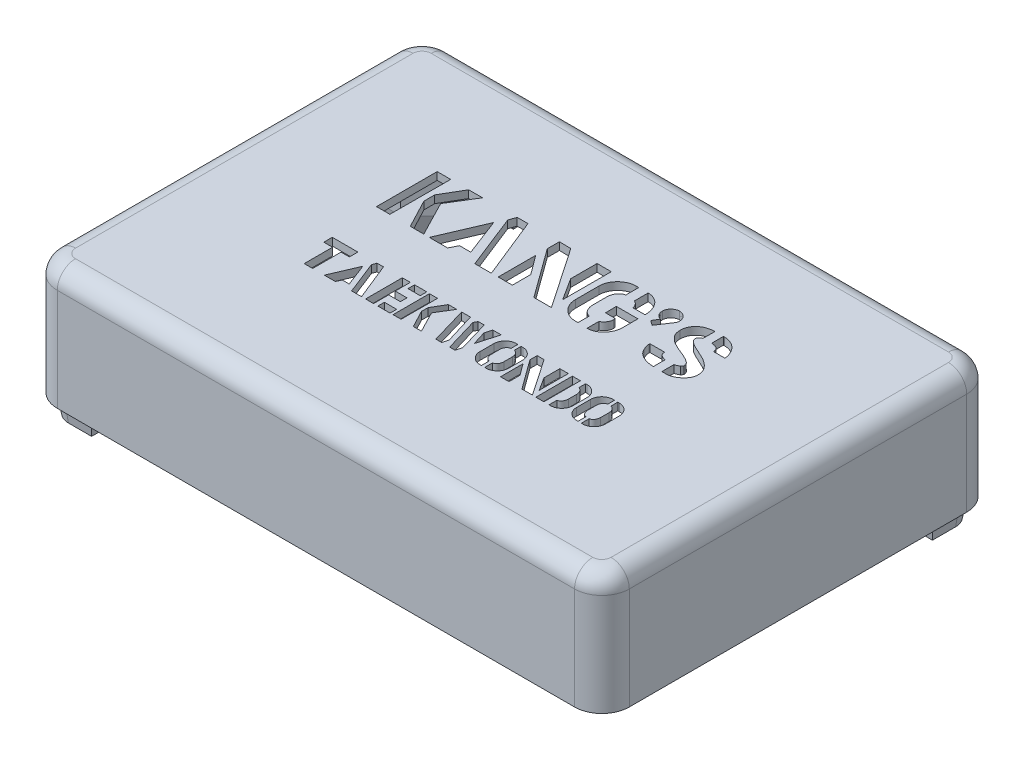
from build123d import *

# Parameters (mm, degrees)
BOSS_EXTRUDE1_DEPTH           = 1.25
BOSS_EXTRUDE2_START           = -18.551161966
BOSS_EXTRUDE2_DEPTH           = 18.551161966
CUT_EXTRUDE1_REACH            = 87.168
SKETCH2_W                     = 44.73
SKETCH2_H                     = 13.53
SKETCH2_W_2                   = 14.25
BOSS_EXTRUDE3_DEPTH           = 18.551161966
BOSS_EXTRUDE4_START           = 18.551162
BOSS_EXTRUDE4_DEPTH           = 3
BOSS_EXTRUDE4_DRAFT           = 10
BOSS_EXTRUDE4_PROFILE_2_DEPTH = 3
BOSS_EXTRUDE4_PROFILE_2_DRAFT = 10
BOSS_EXTRUDE4_PROFILE_3_DEPTH = 3
BOSS_EXTRUDE4_PROFILE_3_DRAFT = 10
FILLET1_R                     = 3
SKETCH4_W                     = 8.836090639
SKETCH4_H                     = 8.085533906
CUT_EXTRUDE2_DEPTH            = 67.181962882
SKETCH5_W                     = 2.014527845
SKETCH5_H                     = 1.084745763
SKETCH5_W_2                   = 1.317191283
SKETCH5_H_2                   = 6
CUT_EXTRUDE3_DEPTH            = 68.140592671


with BuildPart() as part:
    # Sketch1 → Boss-Extrude1 (new body)
    # profile 1 of 2: a face of its own
    with BuildSketch(Plane(origin=(0, 0, 0), x_dir=(1, 0, 0), z_dir=(0, 1, 0))):
        with BuildLine():
            ThreePointArc((-37, -35.095814403), (-40.181980515, -33.777794919), (-41.5, -30.595814403))
            Line((-41.5, -30.595814403), (-41.5, 24.85))
            ThreePointArc((-41.5, 24.85), (-40.181980515, 28.031980515), (-37, 29.35))
            Line((-37, 29.35), (48, 29.35))
            ThreePointArc((48, 29.35), (51.181980515, 28.031980515), (52.5, 24.85))
            Line((52.5, 24.85), (52.5, -30.595814403))
            ThreePointArc((52.5, -30.595814403), (51.181980515, -33.777794919), (48, -35.095814403))
            Line((48, -35.095814403), (-37, -35.095814403))
        make_face()
        with BuildLine():
            Line((-37, 27.85), (48, 27.85))
            ThreePointArc((48, 27.85), (50.121320344, 26.971320344), (51, 24.85))
            Line((51, 24.85), (51, -30.595814403))
            ThreePointArc((51, -30.595814403), (50.121320344, -32.717134747), (48, -33.595814403))
            Line((48, -33.595814403), (-37, -33.595814403))
            ThreePointArc((-37, -33.595814403), (-39.121320344, -32.717134747), (-40, -30.595814403))
            Line((-40, -30.595814403), (-40, 24.85))
            ThreePointArc((-40, 24.85), (-39.121320344, 26.971320344), (-37, 27.85))
        make_face(mode=Mode.SUBTRACT)
    # profile 2 of 2: a face of its own
    with BuildSketch(Plane(origin=(0, 0, 0), x_dir=(1, 0, 0), z_dir=(0, 1, 0))):
        with BuildLine():
            ThreePointArc((48, 27.85), (50.121320344, 26.971320344), (51, 24.85))
            Line((51, 24.85), (51, -30.595814403))
            ThreePointArc((51, -30.595814403), (50.121320344, -32.717134747), (48, -33.595814403))
            Line((48, -33.595814403), (-37, -33.595814403))
            ThreePointArc((-37, -33.595814403), (-39.121320344, -32.717134747), (-40, -30.595814403))
            Line((-40, -30.595814403), (-40, 24.85))
            ThreePointArc((-40, 24.85), (-39.121320344, 26.971320344), (-37, 27.85))
            Line((-37, 27.85), (48, 27.85))
        make_face()
    extrude(amount=BOSS_EXTRUDE1_DEPTH)

    # Sketch1<3> → Boss-Extrude2 (add)
    with BuildSketch(Plane(origin=(0, 0, 0), x_dir=(1, 0, 0), z_dir=(0, 1, 0)).offset(BOSS_EXTRUDE2_START)):
        with BuildLine():
            Line((-41.5, -30.595814403), (-41.5, 24.85))
            ThreePointArc((-41.5, 24.85), (-40.181980515, 28.031980515), (-37, 29.35))
            Line((-37, 29.35), (48, 29.35))
            ThreePointArc((48, 29.35), (51.181980515, 28.031980515), (52.5, 24.85))
            Line((52.5, 24.85), (52.5, -30.595814403))
            ThreePointArc((52.5, -30.595814403), (51.181980515, -33.777794919), (48, -35.095814403))
            Line((48, -35.095814403), (-37, -35.095814403))
            ThreePointArc((-37, -35.095814403), (-40.181980515, -33.777794919), (-41.5, -30.595814403))
        make_face()
        with BuildLine():
            Line((-37, -33.595814403), (48, -33.595814403))
            ThreePointArc((48, -33.595814403), (50.121320344, -32.717134747), (51, -30.595814403))
            Line((51, -30.595814403), (51, 24.85))
            ThreePointArc((51, 24.85), (50.121320344, 26.971320344), (48, 27.85))
            Line((48, 27.85), (-37, 27.85))
            ThreePointArc((-37, 27.85), (-39.121320344, 26.971320344), (-40, 24.85))
            Line((-40, 24.85), (-40, -30.595814403))
            ThreePointArc((-40, -30.595814403), (-39.121320344, -32.717134747), (-37, -33.595814403))
        make_face(mode=Mode.SUBTRACT)
    extrude(amount=BOSS_EXTRUDE2_DEPTH)

    # Sketch2 → Cut-Extrude1 (cut, up to next)
    with BuildSketch(Plane(origin=(0, 0, -29.35), x_dir=(-1, 0, 0), z_dir=(0, 0, -1)), mode=Mode.PRIVATE) as cut_extrude1_sk1:
        with Locations((2.66, -11.786161966)):
            Rectangle(SKETCH2_W, SKETCH2_H)
    cut_extrude1_tool1 = extrude(cut_extrude1_sk1.sketch, amount=-CUT_EXTRUDE1_REACH, mode=Mode.PRIVATE) & part.part
    # Sketch2 → Cut-Extrude1 (cut, up to next)
    with BuildSketch(Plane(origin=(0, 0, -29.35), x_dir=(-1, 0, 0), z_dir=(0, 0, -1)), mode=Mode.PRIVATE) as cut_extrude1_sk2:
        with Locations((-32.9, -11.786161966)):
            Rectangle(SKETCH2_W_2, SKETCH2_H)
    cut_extrude1_tool2 = extrude(cut_extrude1_sk2.sketch, amount=-CUT_EXTRUDE1_REACH, mode=Mode.PRIVATE) & part.part
    add(cut_extrude1_tool1.solids().sort_by_distance((-2.66, -11.786162, -29.35))[0], mode=Mode.SUBTRACT)
    add(cut_extrude1_tool2.solids().sort_by_distance((32.9, -11.786162, -29.35))[0], mode=Mode.SUBTRACT)

    # Sketch3 → Boss-Extrude3 (add)
    with BuildSketch(Plane.XZ):
        with BuildLine():
            Line((-32.664466094, -28.05), (-32.664466094, -24.05))
            Line((-32.664466094, -24.05), (-36.2, -20.514466094))
            Line((-36.2, -20.514466094), (-40.2, -20.514466094))
            Line((-40.2, -20.514466094), (-40.2, -24.85))
            ThreePointArc((-40.2, -24.85), (-39.2627417, -27.1127417), (-37, -28.05))
            Line((-37, -28.05), (-32.664466094, -28.05))
        make_face()
        with BuildLine():
            Line((-40.2, 26.260280497), (-36.2, 26.260280497))
            Line((-36.2, 26.260280497), (-32.664466094, 29.795814403))
            Line((-32.664466094, 29.795814403), (-32.664466094, 33.795814403))
            Line((-32.664466094, 33.795814403), (-37, 33.795814403))
            ThreePointArc((-37, 33.795814403), (-39.2627417, 32.858556103), (-40.2, 30.595814403))
            Line((-40.2, 30.595814403), (-40.2, 26.260280497))
        make_face()
        with BuildLine():
            Line((47.2, -20.514466094), (43.664466094, -24.05))
            Line((43.664466094, -24.05), (43.664466094, -28.05))
            Line((43.664466094, -28.05), (48, -28.05))
            ThreePointArc((48, -28.05), (50.2627417, -27.1127417), (51.2, -24.85))
            Line((51.2, -24.85), (51.2, -20.514466094))
            Line((51.2, -20.514466094), (47.2, -20.514466094))
        make_face()
    extrude(amount=BOSS_EXTRUDE3_DEPTH)


with BuildPart() as boss_extrude4_tool:
    # Sketch3<3> → Boss-Extrude4 (with draft: the straight prism first)
    with BuildSketch(Plane.XZ.offset(BOSS_EXTRUDE4_START)):
        with BuildLine():
            Line((-32.664466094, -24.05), (-36.2, -20.514466094))
            Line((-36.2, -20.514466094), (-40.2, -20.514466094))
            Line((-40.2, -20.514466094), (-40.2, -24.85))
            ThreePointArc((-40.2, -24.85), (-39.2627417, -27.1127417), (-37, -28.05))
            Line((-37, -28.05), (-32.664466094, -28.05))
            Line((-32.664466094, -28.05), (-32.664466094, -24.05))
        make_face()
    extrude(amount=BOSS_EXTRUDE4_DEPTH)
    # Boss-Extrude4: the draft: its side faces are tilted about the plane it starts from
    boss_extrude4_sides = [boss_extrude4_tool.faces().sort_by_distance(p)[0] for p in [
        (-34.832233047, -20.051162, -28.05),
        (-32.664466094, -20.051162, -26.05),
        (-34.432233047, -20.051162, -22.282233047),
        (-38.2, -20.051162, -20.514466094),
        (-40.2, -20.051162, -22.682233047),
        (-39.2627417, -20.051162, -27.1127417),
    ]]
    draft(boss_extrude4_sides, Plane.XZ.offset(BOSS_EXTRUDE4_START), BOSS_EXTRUDE4_DRAFT)


with BuildPart() as part_1:
    add(part.part)

    # Boss-Extrude4: add boss_extrude4_tool
    add(boss_extrude4_tool.part)


with BuildPart() as boss_extrude4_profile_2_tool:
    # Sketch3<3> → Boss-Extrude4 profile 2 (with draft: the straight prism first)
    with BuildSketch(Plane.XZ.offset(BOSS_EXTRUDE4_START)):
        with BuildLine():
            Line((-36.2, 26.260280497), (-32.664466094, 29.795814403))
            Line((-32.664466094, 29.795814403), (-32.664466094, 33.795814403))
            Line((-32.664466094, 33.795814403), (-37, 33.795814403))
            ThreePointArc((-37, 33.795814403), (-39.2627417, 32.858556103), (-40.2, 30.595814403))
            Line((-40.2, 30.595814403), (-40.2, 26.260280497))
            Line((-40.2, 26.260280497), (-36.2, 26.260280497))
        make_face()
    extrude(amount=BOSS_EXTRUDE4_PROFILE_2_DEPTH)
    # Boss-Extrude4 profile 2: the draft: its side faces are tilted about the plane it starts from
    boss_extrude4_profile_2_sides = [boss_extrude4_profile_2_tool.faces().sort_by_distance(p)[0] for p in [
        (-34.432233047, -20.051162, 28.02804745),
        (-32.664466094, -20.051162, 31.795814403),
        (-34.832233047, -20.051162, 33.795814403),
        (-39.2627417, -20.051162, 32.858556103),
        (-40.2, -20.051162, 28.42804745),
        (-38.2, -20.051162, 26.260280497),
    ]]
    draft(boss_extrude4_profile_2_sides, Plane.XZ.offset(BOSS_EXTRUDE4_START), BOSS_EXTRUDE4_PROFILE_2_DRAFT)


with BuildPart() as part_2:
    add(part_1.part)

    # Boss-Extrude4 profile 2: add boss_extrude4_profile_2_tool
    add(boss_extrude4_profile_2_tool.part)


with BuildPart() as boss_extrude4_profile_3_tool:
    # Sketch3<3> → Boss-Extrude4 profile 3 (with draft: the straight prism first)
    with BuildSketch(Plane.XZ.offset(BOSS_EXTRUDE4_START)):
        with BuildLine():
            Line((43.664466094, -24.05), (43.664466094, -28.05))
            Line((43.664466094, -28.05), (48, -28.05))
            ThreePointArc((48, -28.05), (50.2627417, -27.1127417), (51.2, -24.85))
            Line((51.2, -24.85), (51.2, -20.514466094))
            Line((51.2, -20.514466094), (47.2, -20.514466094))
            Line((47.2, -20.514466094), (43.664466094, -24.05))
        make_face()
    extrude(amount=BOSS_EXTRUDE4_PROFILE_3_DEPTH)
    # Boss-Extrude4 profile 3: the draft: its side faces are tilted about the plane it starts from
    boss_extrude4_profile_3_sides = [boss_extrude4_profile_3_tool.faces().sort_by_distance(p)[0] for p in [
        (43.664466094, -20.051162, -26.05),
        (45.832233047, -20.051162, -28.05),
        (50.2627417, -20.051162, -27.1127417),
        (51.2, -20.051162, -22.682233047),
        (49.2, -20.051162, -20.514466094),
        (45.432233047, -20.051162, -22.282233047),
    ]]
    draft(boss_extrude4_profile_3_sides, Plane.XZ.offset(BOSS_EXTRUDE4_START), BOSS_EXTRUDE4_PROFILE_3_DRAFT)


with BuildPart() as part_3:
    add(part_2.part)

    # Boss-Extrude4 profile 3: add boss_extrude4_profile_3_tool
    add(boss_extrude4_profile_3_tool.part)

    # Fillet1
    fillet1_edges = [part_3.edges().sort_by_distance(p)[0] for p in [
        (-34.432233047, 0, -22.282233047),
        (51.181980515, 1.25, 33.777794919),
        (7.667766953, 0, 33.595814403),
        (-38.1, 0, 26.260280497),
        (-32.664466094, 0, 31.695814403),
        (-34.432233047, 0, 28.02804745),
        (5.5, 0, -27.85),
        (43.664466094, 0, -25.95),
        (49.1, 0, -20.514466094),
        (45.432233047, 0, -22.282233047),
        (52.5, 1.25, 2.872907202),
        (51.181980515, 1.25, -28.031980515),
        (5.5, 1.25, -29.35),
        (-40.181980515, 1.25, -28.031980515),
        (50.121320344, 0, 32.717134747),
        (-41.5, 1.25, 2.872907202),
        (51, 0, 5.040674155),
        (-40.181980515, 1.25, 33.777794919),
        (5.5, 1.25, 35.095814403),
        (-40, 0, 2.872907202),
        (-32.664466094, 0, -25.95),
        (-38.1, 0, -20.514466094),
    ]]
    fillet(fillet1_edges, radius=FILLET1_R)

    # Sketch4 → Cut-Extrude2 (cut, through all)
    with BuildSketch(Plane.XZ.offset(18.551161966)):
        with Locations((42.031954681, -25.307233047)):
            Rectangle(SKETCH4_W, SKETCH4_H)
    extrude(amount=CUT_EXTRUDE2_DEPTH, mode=Mode.SUBTRACT)

    # Sketch5 → Cut-Extrude3 (cut, through all)
    with BuildSketch(Plane(origin=(0, 1.25, 0), x_dir=(1, 0, 0), z_dir=(0, 1, 0))):
        Polygon((-12.217917676, 10.014124294), (-14.838983051, 5.746569814), (-11.882970137, 0.014124294), (-14.100484262, 0.014124294), (-16.568200161, 4.713478612), (-16.568200161, 6.499192897), (-14.504035513, 10.014124294), align=None)
        Polygon((-17.486279257, 0.042372881), (-19.681598063, 0.042372881), (-19.681598063, 10.014124294), (-17.45803067, 10.014124294), align=None)
        Polygon((-4.820823245, 10.072639225), (-0.761097659, 0), (-3.481033091, 0), (-6.995964487, 8.92251816), (-6.59039548, 10.072639225), align=None)
        Polygon((-10.97094431, 0), (-7.790960452, 7.407183212), (-5.44834544, 1.305488297), (-7.302663438, 1.305488297), (-7.958434221, 0), align=None)
        Polygon((2.245359161, 10.044390638), (9.065375303, 0.044390638), (6.177966102, 0.044390638), (0.334543987, 8.091202583), (0.348668281, 10.072639225), align=None)
        Polygon((6.533091203, 5.734463277), (6.533091203, 10.072639225), (8.871670702, 10.072639225), (8.857546408, 2.094430993), align=None)
        Polygon((2.658999193, 0.028248588), (0.334543987, 0.028248588), (0.334543987, 6.192493947), (2.658999193, 3.05488297), align=None)
        with BuildLine():
            Line((13.383373688, 0.086763519), (12.95157385, 0.086763519))
            add(Edge.make_bspline(
                [(12.95157385, 0.086763519), (12.848511171, 0.090046505), (12.643365201, 0.096581279), (12.339999042, 0.143543833), (12.044994232, 0.223721271), (11.759336815, 0.331711932), (11.488708969, 0.46903058), (11.234686297, 0.627785702), (10.997967353, 0.804784151), (10.781065452, 1.003534163), (10.585555193, 1.221496062), (10.410885433, 1.45742119), (10.256842547, 1.710332663), (10.126435505, 1.979853331), (10.020536893, 2.261839894), (9.947201843, 2.553653952), (9.897527741, 2.851411079), (9.892941351, 3.052663874), (9.890637611, 3.153753027)],
                knots=[0, 0, 0, 0, 1.030497233, 2.05120183, 3.061145804, 4.082980002, 5.099687741, 6.090707789, 7.075407959, 8.051339886, 9.027735263, 9.998997243, 10.982962048, 11.98469761, 12.989206787, 13.989224726, 14.989988836, 16, 16, 16, 16], degree=3))
            Line((9.890637611, 3.153753027), (9.890637611, 7.003631961))
            add(Edge.make_bspline(
                [(9.890637611, 7.003631961), (9.892958487, 7.104716525), (9.897578991, 7.305960183), (9.946892184, 7.603141069), (10.020949214, 7.894083658), (10.126300824, 8.175579292), (10.257445622, 8.445348196), (10.410260404, 8.699656309), (10.585536158, 8.935951531), (10.781731285, 9.153780969), (10.997221774, 9.354786207), (11.234876178, 9.531314267), (11.488070847, 9.690992483), (11.760384667, 9.824644934), (12.044439876, 9.936404647), (12.340085237, 10.015648014), (12.643343315, 10.062875015), (12.848503853, 10.069374146), (12.95157385, 10.072639225)],
                knots=[0, 0, 0, 0, 1.009809341, 2.010373476, 3.00367982, 4.007988273, 5.009523666, 5.99904406, 6.970111961, 7.946312232, 8.926603665, 9.911107069, 10.901929089, 11.915426284, 12.939465882, 13.949208046, 14.969708683, 16, 16, 16, 16], degree=3))
            Line((12.95157385, 10.072639225), (13.383373688, 10.072639225))
            Line((13.383373688, 10.072639225), (13.383373688, 7.937853107))
            add(Edge.make_bspline(
                [(13.383373688, 7.937853107), (13.33129642, 7.929026033), (13.229042513, 7.91169404), (13.081857766, 7.864192696), (12.943617758, 7.799937245), (12.77569429, 7.688364067), (12.587265134, 7.520998207), (12.404519945, 7.278959989), (12.263733351, 7.006353522), (12.163120275, 6.71377729), (12.097846959, 6.413247789), (12.089868334, 6.210963575), (12.085956416, 6.111783697)],
                knots=[0, 0, 0, 0, 0.649488645, 1.275273328, 1.897487876, 2.51981258, 3.7512292, 4.979915218, 6.231594117, 7.5119956, 8.780132316, 10, 10, 10, 10], degree=3))
            Line((12.085956416, 6.111783697), (12.085956416, 3.795399516))
            add(Edge.make_bspline(
                [(12.085956416, 3.795399516), (12.089849874, 3.696892666), (12.097766348, 3.496601034), (12.16291171, 3.199286505), (12.265445898, 2.908948641), (12.4048923, 2.63412823), (12.586155528, 2.387085797), (12.774265089, 2.216075812), (12.944258669, 2.107574115), (13.081774425, 2.042860946), (13.229064323, 1.99552308), (13.33130378, 1.978168621), (13.383373688, 1.969330105)],
                knots=[0, 0, 0, 0, 1.212153435, 2.464642723, 3.729993484, 4.996942749, 6.246031211, 7.483531307, 8.101657328, 8.724152176, 9.350218768, 10, 10, 10, 10], degree=3))
            Line((13.383373688, 1.969330105), (13.383373688, 0.086763519))
        make_face()
        with BuildLine():
            Line((14.244955609, 3.744955609), (14.216707022, 5.552865214))
            Line((14.216707022, 5.552865214), (17.767958031, 5.552865214))
            Line((17.767958031, 5.552865214), (17.767958031, 3.089184826))
            add(Edge.make_bspline(
                [(17.767958031, 3.089184826), (17.76488189, 2.988202025), (17.758789676, 2.788208245), (17.720992417, 2.491038189), (17.650920137, 2.203302706), (17.558963429, 1.92396396), (17.440695002, 1.658249958), (17.305215394, 1.404189997), (17.141612691, 1.170114897), (16.960861938, 0.951905271), (16.760073974, 0.753275428), (16.541110659, 0.574963881), (16.304726836, 0.417342419), (16.052077076, 0.282149235), (15.787101141, 0.170745444), (15.509743183, 0.089326617), (15.222001172, 0.038196816), (15.02602815, 0.02756836), (14.926957224, 0.022195319)],
                knots=[0, 0, 0, 0, 1.046784458, 2.073129081, 3.097767789, 4.111799308, 5.116877793, 6.108840655, 7.091130162, 8.071141376, 9.042211172, 10.013356029, 10.993590353, 11.982240979, 12.979090627, 13.967298783, 14.972401443, 16, 16, 16, 16], degree=3))
            Line((14.926957224, 0.022195319), (14.926957224, 1.987489911))
            add(Edge.make_bspline(
                [(14.926957224, 1.987489911), (14.991912137, 2.018568616), (15.122632679, 2.081113924), (15.301693108, 2.210814407), (15.464315503, 2.370766688), (15.609144217, 2.556108769), (15.730940101, 2.758324228), (15.821890026, 2.970320805), (15.876306043, 3.188700808), (15.883716506, 3.336405575), (15.887409201, 3.410008071)],
                knots=[0, 0, 0, 0, 0.954037792, 1.919983107, 2.917213139, 3.972428214, 5.033177375, 6.041054575, 7.023841438, 8, 8, 8, 8], degree=3))
            add(Edge.make_bspline(
                [(15.887409201, 3.410008071), (15.886414413, 3.435595214), (15.884235975, 3.491627249), (15.873083781, 3.57754354), (15.862971044, 3.663961655), (15.852067417, 3.719445077), (15.847054076, 3.744955609)],
                knots=[0, 0, 0, 0, 0.909440179, 1.991538659, 3.076536445, 4, 4, 4, 4], degree=3))
            Line((15.847054076, 3.744955609), (14.244955609, 3.744955609))
        make_face()
        with BuildLine():
            add(Edge.make_bspline(
                [(15.804681195, 6.715092817), (15.785500983, 6.775312296), (15.747657417, 6.894128498), (15.674270636, 7.064087727), (15.589306954, 7.224045318), (15.492740436, 7.374781946), (15.379815352, 7.513156482), (15.247658057, 7.634974393), (15.096252447, 7.739935323), (14.984299266, 7.793425669), (14.926957224, 7.820823245)],
                knots=[0, 0, 0, 0, 1.038117861, 2.048261179, 3.037197711, 4.012136952, 4.985822251, 5.963576981, 6.956950992, 8, 8, 8, 8], degree=3))
            Line((14.926957224, 7.820823245), (14.926957224, 10.072639225))
            add(Edge.make_bspline(
                [(14.926957224, 10.072639225), (15.038148399, 10.066899214), (15.25586436, 10.055660083), (15.572195859, 9.999741696), (15.867831549, 9.905510218), (16.142372203, 9.779511749), (16.397697939, 9.628288656), (16.62993474, 9.451590766), (16.842500733, 9.254385419), (17.031477157, 9.034247449), (17.199001939, 8.793865114), (17.349596649, 8.538710215), (17.473410065, 8.263487904), (17.581025451, 7.975490417), (17.66599749, 7.67399004), (17.722958816, 7.361761273), (17.761431374, 7.041581184), (17.765764148, 6.824839208), (17.767958031, 6.715092817)],
                knots=[0, 0, 0, 0, 1.089548312, 2.13337127, 3.135233695, 4.119604243, 5.085313417, 6.035012562, 6.971627958, 7.919567108, 8.869700036, 9.837741952, 10.816123728, 11.820515648, 12.846399576, 13.878458949, 14.925766581, 16, 16, 16, 16], degree=3))
            Line((17.767958031, 6.715092817), (15.804681195, 6.715092817))
        make_face()
        with BuildLine():
            Line((19.059322034, 6.361985472), (19.646489104, 7.352703793))
            add(Edge.make_bspline(
                [(19.646489104, 7.352703793), (19.575530791, 7.37582894), (19.43597432, 7.421310063), (19.245593422, 7.531085277), (19.078407529, 7.670753145), (18.933271926, 7.835622126), (18.816412071, 8.022383475), (18.733332786, 8.22514302), (18.680185326, 8.439574026), (18.674698303, 8.587256868), (18.671912833, 8.662227603)],
                knots=[0, 0, 0, 0, 1.018864026, 2.003839468, 2.984075487, 3.98820656, 4.99675493, 5.9827614, 6.9759551, 8, 8, 8, 8], degree=3))
            add(Edge.make_bspline(
                [(18.671912833, 8.662227603), (18.673544272, 8.710743916), (18.67675648, 8.806269662), (18.69987097, 8.946910463), (18.736144971, 9.082875915), (18.803104456, 9.25602934), (18.915930552, 9.456347641), (19.091510478, 9.664724476), (19.301856614, 9.836218491), (19.501603026, 9.944605731), (19.671350984, 10.01315226), (19.806691847, 10.046131155), (19.944923605, 10.07025761), (20.039171197, 10.071844624), (20.086359968, 10.072639225)],
                knots=[0, 0, 0, 0, 0.78996274, 1.55538982, 2.31538855, 3.078302937, 4.574346892, 6.035901131, 7.49190241, 8.967715255, 9.72041529, 10.467032153, 11.232459233, 12, 12, 12, 12], degree=3))
            add(Edge.make_bspline(
                [(20.086359968, 10.072639225), (20.180561667, 10.067428905), (20.368167708, 10.057052366), (20.635731044, 9.966803121), (20.879926063, 9.837202304), (21.09323168, 9.66533986), (21.268676296, 9.456250607), (21.382216166, 9.256158148), (21.447883943, 9.082492337), (21.48829792, 8.947479602), (21.507206532, 8.806014519), (21.510990018, 8.710692034), (21.51291364, 8.662227603)],
                knots=[0, 0, 0, 0, 1.269612719, 2.528478964, 3.776737799, 4.991667953, 6.204148375, 7.445240876, 8.078141615, 8.711042355, 9.34466041, 10, 10, 10, 10], degree=3))
            add(Edge.make_bspline(
                [(21.51291364, 8.662227603), (21.51189001, 8.606930897), (21.509978663, 8.50367957), (21.482812393, 8.360804563), (21.442929562, 8.236584875), (21.392035308, 8.125304076), (21.330705885, 8.020785381), (21.256627402, 7.921061016), (21.176305655, 7.812303055), (21.127482614, 7.731173498), (21.101291364, 7.687651332)],
                knots=[0, 0, 0, 0, 1.225871234, 2.288975967, 3.214512543, 4.116626368, 5.000135334, 5.899278413, 6.87306233, 8, 8, 8, 8], degree=3))
            Line((21.101291364, 7.687651332), (19.852300242, 5.790960452))
            Line((19.852300242, 5.790960452), (19.059322034, 6.361985472))
        make_face()
        with BuildLine():
            add(Edge.make_bspline(
                [(25.82889427, 0.014124294), (25.67730622, 0.022946992), (25.36645531, 0.041039076), (24.89871411, 0.11863732), (24.43237985, 0.239384478), (24.055935214, 0.380400028), (23.769438133, 0.51927915), (23.566287673, 0.641381194), (23.370696931, 0.775083402), (23.185596198, 0.923037832), (23.015135836, 1.087507813), (22.867079524, 1.272067766), (22.73657888, 1.470639688), (22.668776893, 1.614648919), (22.634786118, 1.686844229)],
                knots=[0, 0, 0, 0, 1.439726894, 2.952346293, 4.489130685, 6.003632958, 6.756976197, 7.506554119, 8.249887153, 9.003230392, 9.752237807, 10.491644445, 11.243824887, 12, 12, 12, 12], degree=3))
            add(Edge.make_bspline(
                [(22.634786118, 1.686844229), (22.59453223, 1.779705988), (22.515078191, 1.962998636), (22.414607382, 2.190718989), (22.347068868, 2.376633409), (22.314226535, 2.5230874), (22.289909338, 2.67473626), (22.288464865, 2.778347191), (22.287732042, 2.830912026)],
                knots=[0, 0, 0, 0, 1.510042566, 2.980556321, 3.713652942, 4.456031365, 5.216699857, 6, 6, 6, 6], degree=3))
            add(Edge.make_bspline(
                [(22.287732042, 2.830912026), (22.287732042, 2.859160613), (22.287732042, 2.914985203), (22.287732042, 2.970809793), (22.287732042, 2.998385795)],
                knots=[0, 0, 0, 0, 1.012048193, 2, 2, 2, 2], degree=3))
            Line((22.287732042, 2.998385795), (24.741323648, 2.998385795))
            Line((24.741323648, 2.998385795), (24.741323648, 2.802663438))
            add(Edge.make_bspline(
                [(24.741323648, 2.802663438), (24.739883167, 2.772948788), (24.737036468, 2.714226249), (24.757809085, 2.629381857), (24.787584139, 2.547039095), (24.854274751, 2.445991471), (24.963623749, 2.333520694), (25.117267577, 2.218112692), (25.292418193, 2.127054912), (25.475761224, 2.053469428), (25.656840801, 2.003950329), (25.774311932, 1.978935402), (25.82889427, 1.967312349)],
                knots=[0, 0, 0, 0, 0.597137178, 1.180071491, 1.747150478, 2.357104528, 3.605221461, 4.894494913, 6.218096733, 7.57644755, 8.873909208, 10, 10, 10, 10], degree=3))
            Line((25.82889427, 1.967312349), (25.82889427, 0.014124294))
        make_face()
        with BuildLine():
            add(Edge.make_bspline(
                [(22.856739306, 7.395076675), (22.859915955, 7.498817924), (22.866137267, 7.701990119), (22.912514814, 7.997586346), (22.991793505, 8.274491008), (23.101091481, 8.532691411), (23.240010081, 8.770138886), (23.397012906, 8.991306583), (23.575642435, 9.192228844), (23.775046519, 9.372817237), (23.993101058, 9.53357988), (24.22797621, 9.676649184), (24.481671392, 9.793735016), (24.747333205, 9.896022626), (25.025523856, 9.972544528), (25.310113403, 10.033345488), (25.602212207, 10.064495988), (25.798568152, 10.06991099), (25.897497982, 10.072639225)],
                knots=[0, 0, 0, 0, 1.098939009, 2.152218648, 3.160466161, 4.143929449, 5.114475637, 6.069646961, 7.013586876, 7.956988626, 8.914788172, 9.880297979, 10.865334996, 11.871237597, 12.893193182, 13.919042323, 14.951553052, 16, 16, 16, 16], degree=3))
            Line((25.897497982, 10.072639225), (25.897497982, 8.13559322))
            add(Edge.make_bspline(
                [(25.897497982, 8.13559322), (25.868595197, 8.115390243), (25.808034836, 8.073058697), (25.714024738, 8.00812516), (25.616931403, 7.934977448), (25.519965377, 7.857267039), (25.430142506, 7.772059502), (25.359270721, 7.677661222), (25.30790864, 7.575282783), (25.301423891, 7.501903042), (25.298224374, 7.465698144)],
                knots=[0, 0, 0, 0, 0.908146097, 1.902849668, 2.942098635, 4.037700156, 5.103317531, 6.118323267, 7.071597793, 8, 8, 8, 8], degree=3))
            add(Edge.make_bspline(
                [(25.298224374, 7.465698144), (25.302576805, 7.397689312), (25.31125455, 7.262095342), (25.392486823, 7.068071574), (25.520937108, 6.889940609), (25.698798897, 6.73029363), (25.911673651, 6.582244458), (26.150361847, 6.435579818), (26.413325264, 6.288843089), (26.808935311, 6.10066802), (27.342014325, 5.863791833), (27.891153467, 5.618011716), (28.343503915, 5.414671951), (28.671886742, 5.235953765), (28.99200159, 5.050591567), (29.295533361, 4.845720104), (29.585121547, 4.631565858), (29.847190619, 4.392942401), (30.082738223, 4.136999718), (30.294645688, 3.863853371), (30.469418151, 3.564119373), (30.592785073, 3.231337938), (30.6694332, 2.868703402), (30.677460606, 2.616081306), (30.681598063, 2.485875706)],
                knots=[0, 0, 0, 0, 0.573914816, 1.144254158, 1.753009416, 2.422307235, 3.157582464, 3.948246568, 4.795048198, 5.707411794, 7.658392333, 9.737205835, 10.805399197, 11.858237929, 12.902949619, 13.938122644, 14.959257865, 15.951640193, 16.935610678, 17.90320935, 18.875745166, 19.862138112, 20.898110686, 22, 22, 22, 22], degree=3))
            add(Edge.make_bspline(
                [(30.681598063, 2.485875706), (30.679219326, 2.407603623), (30.674440024, 2.250341176), (30.624786085, 2.018229817), (30.5509775, 1.788936348), (30.441749872, 1.569171456), (30.313973584, 1.356225953), (30.164925637, 1.154539004), (29.997222788, 0.965852723), (29.814644461, 0.787966607), (29.615725079, 0.627853306), (29.408622908, 0.478579689), (29.187738673, 0.351094615), (28.961735544, 0.237068268), (28.730230936, 0.147511612), (28.500733339, 0.077358444), (28.272534346, 0.034161454), (28.121223806, 0.023454068), (28.046408394, 0.018159806)],
                knots=[0, 0, 0, 0, 0.955740518, 1.920251582, 2.890321632, 3.894514103, 4.912852476, 5.924460272, 6.955767427, 7.996865693, 9.037281579, 10.075549928, 11.115087813, 12.152280726, 13.167892263, 14.146258853, 15.083418717, 16, 16, 16, 16], degree=3))
            Line((28.046408394, 0.018159806), (27.237288136, 0.004035513))
            Line((27.237288136, 0.004035513), (27.237288136, 1.997578692))
            add(Edge.make_bspline(
                [(27.237288136, 1.997578692), (27.305249228, 2.013617472), (27.439377284, 2.045271618), (27.62784813, 2.12974767), (27.811088107, 2.221030058), (27.939635903, 2.268426523), (28.004035513, 2.292171106)],
                knots=[0, 0, 0, 0, 1.015670118, 2.004527203, 3.000312161, 4, 4, 4, 4], degree=3))
            add(Edge.make_bspline(
                [(28.004035513, 2.292171106), (28.009974242, 2.301663414), (28.024624149, 2.325079436), (28.054721734, 2.364679706), (28.086341735, 2.422430255), (28.130358832, 2.485352241), (28.16770532, 2.551427973), (28.201997313, 2.605257436), (28.221882574, 2.647416552), (28.226303356, 2.672091913), (28.228006457, 2.681598063)],
                knots=[0, 0, 0, 0, 0.595263766, 1.468421476, 2.639994664, 4.088404572, 5.548250631, 6.670754065, 7.487909766, 8, 8, 8, 8], degree=3))
            add(Edge.make_bspline(
                [(28.228006457, 2.681598063), (28.2237401, 2.753600998), (28.215321764, 2.895676523), (28.135431144, 3.09789553), (28.006270549, 3.279111123), (27.827877619, 3.43741247), (27.613920262, 3.579910432), (27.379226706, 3.727530475), (27.114274641, 3.862997082), (26.724158766, 4.044461166), (26.197588058, 4.267728407), (25.650653926, 4.484123631), (25.203513936, 4.669858545), (24.874897717, 4.825286943), (24.557010432, 4.993378304), (24.251169241, 5.172583527), (23.963225464, 5.369628755), (23.70023231, 5.587629502), (23.463758215, 5.825701957), (23.283522576, 6.036652294), (23.159804047, 6.21923966), (23.077636933, 6.363801629), (23.010224043, 6.516991331), (22.952238438, 6.677012213), (22.91145678, 6.845819825), (22.877855334, 7.021328167), (22.86024987, 7.205719039), (22.857924471, 7.331149606), (22.856739306, 7.395076675)],
                knots=[0, 0, 0, 0, 0.734506928, 1.449322253, 2.190511326, 2.994563417, 3.875078424, 4.820978445, 5.831129349, 6.91844484, 9.225677754, 11.684396252, 12.940190615, 14.181422955, 15.40418469, 16.620454424, 17.808408341, 18.972090236, 20.111357517, 21.240656605, 21.805925012, 22.36702661, 22.940289782, 23.517385603, 24.106876024, 24.715945645, 25.345567576, 26, 26, 26, 26], degree=3))
        make_face()
        with BuildLine():
            Line((27.293785311, 10.072639225), (27.350282486, 10.086763519))
            add(Edge.make_bspline(
                [(27.350282486, 10.086763519), (27.457386724, 10.084234711), (27.667752457, 10.079267826), (27.976205536, 10.034602385), (28.273016224, 9.967737417), (28.554794085, 9.867670677), (28.822148063, 9.744440873), (29.072480035, 9.598772474), (29.307056283, 9.433039435), (29.520810267, 9.242237903), (29.715950662, 9.031762149), (29.895754206, 8.805162588), (30.052580341, 8.557351796), (30.191224681, 8.293420529), (30.311764627, 8.014851363), (30.404306617, 7.721424482), (30.481703707, 7.417260373), (30.51258128, 7.208451717), (30.528248588, 7.102502018)],
                knots=[0, 0, 0, 0, 1.071650163, 2.104851089, 3.114234825, 4.112984497, 5.092112078, 6.057600332, 7.008634247, 7.962595562, 8.920185788, 9.87926628, 10.854287221, 11.851242153, 12.861815498, 13.888170095, 14.928455611, 16, 16, 16, 16], degree=3))
            Line((30.528248588, 7.102502018), (28.716303471, 7.102502018))
            add(Edge.make_bspline(
                [(28.716303471, 7.102502018), (28.705168394, 7.104271596), (28.682012378, 7.107951532), (28.652444265, 7.133187997), (28.629894314, 7.17206074), (28.613238702, 7.237120546), (28.597404124, 7.308296503), (28.592882653, 7.362740167), (28.591202583, 7.382970137)],
                knots=[0, 0, 0, 0, 0.604358963, 1.256798314, 2.029817941, 3.02666005, 4.895177635, 6, 6, 6, 6], degree=3))
            add(Edge.make_bspline(
                [(28.591202583, 7.382970137), (28.590285628, 7.412031779), (28.588491573, 7.468891946), (28.567312452, 7.549946323), (28.535011196, 7.625073679), (28.470701138, 7.713326859), (28.372101386, 7.813055177), (28.276477017, 7.871771215), (28.228006457, 7.901533495)],
                knots=[0, 0, 0, 0, 0.783019467, 1.53200627, 2.247647846, 2.978347603, 4.468369656, 6, 6, 6, 6], degree=3))
            add(Edge.make_bspline(
                [(28.228006457, 7.901533495), (28.156650512, 7.940358519), (28.013190675, 8.018415528), (27.773958441, 8.07787005), (27.534045088, 8.120773618), (27.373253825, 8.142844731), (27.293785311, 8.153753027)],
                knots=[0, 0, 0, 0, 0.996125462, 2.002692238, 3.012862528, 4, 4, 4, 4], degree=3))
            Line((27.293785311, 8.153753027), (27.293785311, 10.072639225))
        make_face()
        Polygon((-16.117433414, -14.003631961), (-17.512106538, -14.003631961), (-17.512106538, -9.351089588), (-18.950363196, -9.351089588), (-18.950363196, -7.956416465), (-14.745762712, -7.956416465), (-14.745762712, -9.351089588), (-16.117433414, -9.351089588), align=None)
        Polygon((-10.532687651, -7.956416465), (-8.0968523, -14), (-9.728813559, -14), (-11.837772397, -8.646489104), (-11.594430993, -7.956416465), align=None)
        Polygon((-14.222760291, -14), (-12.314769976, -9.555690073), (-10.909200969, -13.216707022), (-12.021791768, -13.216707022), (-12.415254237, -14), align=None)
        with Locations((-4.417675545, -13.457627118)):
            Rectangle(SKETCH5_W, SKETCH5_H)
        with Locations((-4.417675545, -8.498789347)):
            Rectangle(SKETCH5_W, SKETCH5_H)
        Polygon((-4.190072639, -10.435835351), (-4.190072639, -11.520581114), (-6.122276029, -11.520581114), (-6.122276029, -14), (-7.439467312, -14), (-7.439467312, -7.956416465), (-6.122276029, -7.956416465), (-6.122276029, -10.435835351), align=None)
        Polygon((1.532687651, -7.991525424), (-0.039951574, -10.552058111), (1.733656174, -13.991525424), (0.4031477, -13.991525424), (-1.07748184, -11.171912833), (-1.07748184, -10.100484262), (0.161016949, -7.991525424), align=None)
        Polygon((-1.628329298, -13.974576271), (-2.945520581, -13.974576271), (-2.945520581, -7.991525424), (-1.611380145, -7.991525424), align=None)
        Polygon((6.013317191, -7.956416465), (7.478208232, -12.927360775), (7.209443099, -13.939467312), (6.323244552, -13.939467312), (4.723970944, -8.516949153), (5.033898305, -7.956416465), align=None)
        Polygon((8.824455206, -7.956416465), (7.837772397, -11.41283293), (7.117433414, -9.119854722), (7.444309927, -7.964891041), align=None)
        Polygon((3.754237288, -7.956416465), (5.268765133, -12.944309927), (5.001210654, -13.939467312), (4.055690073, -13.939467312), (2.3062954, -7.956416465), align=None)
        with BuildLine():
            Line((12.083535109, -7.956416465), (12.351089588, -7.956416465))
            add(Edge.make_bspline(
                [(12.351089588, -7.956416465), (12.412932699, -7.958372318), (12.536031237, -7.962265437), (12.717969651, -7.990648817), (12.895054686, -8.037919693), (13.064925318, -8.105443562), (13.228124054, -8.185794006), (13.380843701, -8.280431661), (13.522532948, -8.387605717), (13.651868637, -8.50764209), (13.769358296, -8.638529291), (13.874909843, -8.779562082), (13.963919234, -8.932942388), (14.040031266, -9.094969963), (14.102270286, -9.263578405), (14.145497392, -9.438175028), (14.173487072, -9.616525487), (14.176468017, -9.737183627), (14.177966102, -9.797820823)],
                knots=[0, 0, 0, 0, 1.031813239, 2.053821336, 3.065055067, 4.08433019, 5.099324499, 6.097330067, 7.077913896, 8.059653393, 9.037295684, 10.009798024, 10.993890875, 11.991100812, 12.994567742, 13.987675793, 14.988698993, 16, 16, 16, 16], degree=3))
            Line((14.177966102, -9.797820823), (14.177966102, -12.107748184))
            add(Edge.make_bspline(
                [(14.177966102, -12.107748184), (14.176478134, -12.168388013), (14.17351732, -12.289051391), (14.145317065, -12.467750526), (14.102513269, -12.642864576), (14.03995165, -12.811771964), (13.964275626, -12.973640353), (13.874534593, -13.126197038), (13.769346258, -13.267000934), (13.65226815, -13.397969052), (13.522087918, -13.516654849), (13.380957893, -13.624108503), (13.227738476, -13.718187337), (13.065554849, -13.800740156), (12.894719745, -13.866003782), (12.718021884, -13.913836693), (12.536017974, -13.942060629), (12.412928264, -13.945975239), (12.351089588, -13.947941889)],
                knots=[0, 0, 0, 0, 1.011506247, 2.012732601, 3.012575778, 4.016246359, 5.013658676, 5.992148796, 6.964848501, 7.942689201, 8.920065765, 9.9008486, 10.89905671, 11.917269445, 12.934322891, 13.945761849, 14.967977358, 16, 16, 16, 16], degree=3))
            Line((12.351089588, -13.947941889), (12.083535109, -13.947941889))
            Line((12.083535109, -13.947941889), (12.083535109, -12.659806295))
            add(Edge.make_bspline(
                [(12.083535109, -12.659806295), (12.114750141, -12.654403149), (12.175922287, -12.643814596), (12.264407159, -12.616947332), (12.346747445, -12.579640345), (12.422454295, -12.531308215), (12.492642024, -12.475711965), (12.556742004, -12.412794646), (12.614358358, -12.342980141), (12.681500019, -12.240835285), (12.75214065, -12.10340341), (12.812952356, -11.928905196), (12.854069836, -11.750876776), (12.858565379, -11.630560703), (12.860774818, -11.571428571)],
                knots=[0, 0, 0, 0, 0.782473772, 1.533415027, 2.278837759, 3.009431431, 3.747813808, 4.488416079, 5.225314811, 5.980549648, 7.506224015, 9.029973446, 10.540311379, 12, 12, 12, 12], degree=3))
            Line((12.860774818, -11.571428571), (12.860774818, -10.182808717))
            add(Edge.make_bspline(
                [(12.860774818, -10.182808717), (12.858553279, -10.123272524), (12.854019196, -10.001761304), (12.812826927, -9.821812104), (12.753158187, -9.645926108), (12.667824708, -9.48286214), (12.560649741, -9.335603506), (12.446857352, -9.236327611), (12.347223994, -9.168354405), (12.264406335, -9.130208899), (12.176143844, -9.10163714), (12.114784855, -9.091247695), (12.083535109, -9.085956416)],
                knots=[0, 0, 0, 0, 1.220307519, 2.490603614, 3.771466759, 5.023596962, 6.25434338, 7.486204, 8.101827966, 8.72426686, 9.350277175, 10, 10, 10, 10], degree=3))
            Line((12.083535109, -9.085956416), (12.083535109, -7.956416465))
        make_face()
        with BuildLine():
            add(Edge.make_bspline(
                [(11.546004843, -9.085956416), (11.514758421, -9.091252603), (11.453405959, -9.101651686), (11.36509597, -9.130153317), (11.282148746, -9.168703495), (11.181410606, -9.235662716), (11.067990988, -9.336181462), (10.958833107, -9.482059044), (10.875657314, -9.646376861), (10.814986925, -9.821576791), (10.775917669, -10.001938773), (10.771118275, -10.12330359), (10.768765133, -10.182808717)],
                knots=[0, 0, 0, 0, 0.649308049, 1.274918727, 1.896960262, 2.519111922, 3.750186136, 4.985121921, 6.232641957, 7.512687413, 8.780471512, 10, 10, 10, 10], degree=3))
            Line((10.768765133, -10.182808717), (10.768765133, -11.571428571))
            add(Edge.make_bspline(
                [(10.768765133, -11.571428571), (10.771108178, -11.630529347), (10.775872236, -11.750697548), (10.81485006, -11.929138584), (10.876731677, -12.102965815), (10.958710363, -12.268459487), (11.067621811, -12.416597651), (11.181122535, -12.518505609), (11.282160689, -12.585518589), (11.365092769, -12.624088046), (11.453406797, -12.652584536), (11.514758704, -12.662984325), (11.546004843, -12.668280872)],
                knots=[0, 0, 0, 0, 1.212067398, 2.464467787, 3.729728735, 4.992819144, 6.241818947, 7.479231207, 8.101792069, 8.724242734, 9.350264888, 10, 10, 10, 10], degree=3))
            Line((11.546004843, -12.668280872), (11.546004843, -13.947941889))
            Line((11.546004843, -13.947941889), (11.286924939, -13.947941889))
            add(Edge.make_bspline(
                [(11.286924939, -13.947941889), (11.225088208, -13.94597049), (11.102002367, -13.942046426), (10.919969749, -13.913892629), (10.743015565, -13.86569672), (10.571775586, -13.801366012), (10.410065482, -13.71779697), (10.25703376, -13.624159656), (10.115923919, -13.516646887), (9.985779675, -13.397950374), (9.868537949, -13.267083489), (9.76371887, -13.125552402), (9.671297821, -12.973798996), (9.593052313, -12.812088382), (9.529513492, -12.642895962), (9.485512369, -12.467807656), (9.455707933, -12.289153346), (9.452956096, -12.168401674), (9.45157385, -12.107748184)],
                knots=[0, 0, 0, 0, 1.030861702, 2.051927304, 3.062228477, 4.084424079, 5.095486746, 6.092571954, 7.07225149, 8.048528587, 9.025269297, 9.996874796, 10.981187611, 11.983277469, 12.988141924, 13.98851355, 14.989631613, 16, 16, 16, 16], degree=3))
            Line((9.45157385, -12.107748184), (9.45157385, -9.797820823))
            add(Edge.make_bspline(
                [(9.45157385, -9.797820823), (9.452966377, -9.737170087), (9.455738683, -9.616423897), (9.485326575, -9.438115332), (9.529760884, -9.263549906), (9.592971505, -9.094652045), (9.671659665, -8.932792489), (9.763343841, -8.780201077), (9.86852648, -8.638447906), (9.986179244, -8.507660579), (10.115478839, -8.387613764), (10.257148349, -8.280380715), (10.40967802, -8.186185153), (10.572405676, -8.104816977), (10.742682352, -8.038227177), (10.920021636, -7.99059243), (11.101989192, -7.962279755), (11.225083802, -7.958377105), (11.286924939, -7.956416465)],
                knots=[0, 0, 0, 0, 1.010167552, 2.01108662, 3.00474532, 4.009410035, 5.011300704, 6.001172112, 6.972584481, 7.949131042, 8.929770216, 9.909255017, 10.906142032, 11.913977355, 12.938380213, 13.948480565, 14.969343206, 16, 16, 16, 16], degree=3))
            Line((11.286924939, -7.956416465), (11.546004843, -7.956416465))
            Line((11.546004843, -7.956416465), (11.546004843, -9.085956416))
        make_face()
        Polygon((15.866828087, -7.973365617), (19.958837772, -13.973365617), (18.226392252, -13.973365617), (14.720338983, -9.14527845), (14.728813559, -7.956416465), align=None)
        Polygon((18.439467312, -10.559322034), (18.439467312, -7.956416465), (19.842615012, -7.956416465), (19.834140436, -12.743341404), align=None)
        Polygon((16.115012107, -13.983050847), (14.720338983, -13.983050847), (14.720338983, -10.284503632), (16.115012107, -12.167070218), align=None)
        with BuildLine():
            Line((22.697336562, -7.983050847), (22.966101695, -7.983050847))
            add(Edge.make_bspline(
                [(22.966101695, -7.983050847), (23.027944806, -7.9850067), (23.151043343, -7.98889982), (23.332981758, -8.0172832), (23.510066793, -8.064554075), (23.679937425, -8.132077944), (23.843136161, -8.212428389), (23.995855807, -8.307066044), (24.137545054, -8.414240099), (24.266880744, -8.534276473), (24.384370403, -8.665163674), (24.489921949, -8.806196465), (24.578931341, -8.959576771), (24.655043373, -9.121604346), (24.717282393, -9.290212788), (24.760509499, -9.46480941), (24.788499179, -9.64315987), (24.791480123, -9.763818009), (24.792978208, -9.824455206)],
                knots=[0, 0, 0, 0, 1.031813239, 2.053821336, 3.065055067, 4.08433019, 5.099324499, 6.097330067, 7.077913896, 8.059653393, 9.037295684, 10.009798024, 10.993890875, 11.991100812, 12.994567742, 13.987675793, 14.988698993, 16, 16, 16, 16], degree=3))
            Line((24.792978208, -9.824455206), (24.792978208, -12.134382567))
            add(Edge.make_bspline(
                [(24.792978208, -12.134382567), (24.791489959, -12.195022235), (24.788528587, -12.315685293), (24.76033249, -12.494386809), (24.717512926, -12.66949183), (24.655010312, -12.838433004), (24.578968792, -13.000491722), (24.489643398, -13.154065137), (24.384025868, -13.29613099), (24.267348865, -13.429379694), (24.137466262, -13.550473427), (23.996302103, -13.659265955), (23.842716631, -13.753247604), (23.680576119, -13.835862257), (23.509729415, -13.901109245), (23.333034647, -13.948946593), (23.151029914, -13.977169349), (23.027940315, -13.981084118), (22.966101695, -13.983050847)],
                knots=[0, 0, 0, 0, 1.009328569, 2.008399376, 3.006089985, 4.007599757, 5.002864738, 5.985038218, 6.961051494, 7.946829292, 8.931231201, 9.913979502, 10.910038563, 11.926059182, 12.940923007, 13.950184431, 14.970199207, 16, 16, 16, 16], degree=3))
            Line((22.966101695, -13.983050847), (22.697336562, -13.983050847))
            Line((22.697336562, -13.983050847), (22.697336562, -12.694915254))
            add(Edge.make_bspline(
                [(22.697336562, -12.694915254), (22.728560714, -12.689555802), (22.790248843, -12.678967378), (22.878880124, -12.651289785), (22.961414714, -12.611776291), (23.062211943, -12.545209065), (23.17595157, -12.443641247), (23.282894436, -12.294311745), (23.367913371, -12.1291228), (23.427887055, -11.951797089), (23.468934238, -11.771014425), (23.473538375, -11.649119122), (23.475786925, -11.589588378)],
                knots=[0, 0, 0, 0, 0.646053449, 1.276378237, 1.887860268, 2.506893447, 3.737294026, 4.974319093, 6.233999892, 7.515406909, 8.786584293, 10, 10, 10, 10], degree=3))
            Line((23.475786925, -11.589588378), (23.475786925, -10.209443099))
            add(Edge.make_bspline(
                [(23.475786925, -10.209443099), (23.473565218, -10.149907179), (23.469030796, -10.028396514), (23.427841167, -9.848443004), (23.368162306, -9.672573528), (23.28286567, -9.509449423), (23.175556084, -9.362410523), (23.061926175, -9.262228219), (22.961426028, -9.195714844), (22.878877022, -9.156220359), (22.790249652, -9.128537609), (22.728560986, -9.117949893), (22.697336562, -9.112590799)],
                knots=[0, 0, 0, 0, 1.219412982, 2.488777897, 3.768702116, 5.019914455, 6.249758685, 7.480716299, 8.102809033, 8.717313297, 9.350753449, 10, 10, 10, 10], degree=3))
            Line((22.697336562, -9.112590799), (22.697336562, -7.983050847))
        make_face()
        with Locations((21.19007264, -10.983050847)):
            Rectangle(SKETCH5_W_2, SKETCH5_H_2)
        with BuildLine():
            Line((27.967312349, -7.956416465), (28.234866828, -7.956416465))
            add(Edge.make_bspline(
                [(28.234866828, -7.956416465), (28.296709939, -7.958372318), (28.419808476, -7.962265437), (28.601746891, -7.990648817), (28.778831926, -8.037919693), (28.948702558, -8.105443562), (29.111901294, -8.185794006), (29.26462094, -8.280431661), (29.406310187, -8.387605717), (29.535645877, -8.50764209), (29.653135536, -8.638529291), (29.758687083, -8.779562082), (29.847696474, -8.932942388), (29.923808506, -9.094969963), (29.986047526, -9.263578405), (30.029274632, -9.438175028), (30.057264312, -9.616525487), (30.060245257, -9.737183627), (30.061743341, -9.797820823)],
                knots=[0, 0, 0, 0, 1.031813239, 2.053821336, 3.065055067, 4.08433019, 5.099324499, 6.097330067, 7.077913896, 8.059653393, 9.037295684, 10.009798024, 10.993890875, 11.991100812, 12.994567742, 13.987675793, 14.988698993, 16, 16, 16, 16], degree=3))
            Line((30.061743341, -9.797820823), (30.061743341, -12.107748184))
            add(Edge.make_bspline(
                [(30.061743341, -12.107748184), (30.060255374, -12.168388013), (30.05729456, -12.289051391), (30.029094305, -12.467750526), (29.986290509, -12.642864576), (29.92372889, -12.811771964), (29.848052866, -12.973640353), (29.758311833, -13.126197038), (29.653123498, -13.267000934), (29.536045389, -13.397969052), (29.405865158, -13.516654849), (29.264735133, -13.624108503), (29.111515715, -13.718187337), (28.949332089, -13.800740156), (28.778496985, -13.866003782), (28.601799124, -13.913836693), (28.419795214, -13.942060629), (28.296705504, -13.945975239), (28.234866828, -13.947941889)],
                knots=[0, 0, 0, 0, 1.011506247, 2.012732601, 3.012575778, 4.016246359, 5.013658676, 5.992148796, 6.964848501, 7.942689201, 8.920065765, 9.9008486, 10.89905671, 11.917269445, 12.934322891, 13.945761849, 14.967977358, 16, 16, 16, 16], degree=3))
            Line((28.234866828, -13.947941889), (27.967312349, -13.947941889))
            Line((27.967312349, -13.947941889), (27.967312349, -12.659806295))
            add(Edge.make_bspline(
                [(27.967312349, -12.659806295), (27.998527381, -12.654403149), (28.059699527, -12.643814596), (28.148184399, -12.616947332), (28.230524684, -12.579640345), (28.306231534, -12.531308215), (28.376419263, -12.475711965), (28.440519243, -12.412794646), (28.498135598, -12.342980141), (28.565277259, -12.240835285), (28.63591789, -12.10340341), (28.696729596, -11.928905196), (28.737847075, -11.750876776), (28.742342619, -11.630560703), (28.744552058, -11.571428571)],
                knots=[0, 0, 0, 0, 0.782473772, 1.533415027, 2.278837759, 3.009431431, 3.747813808, 4.488416079, 5.225314811, 5.980549648, 7.506224015, 9.029973446, 10.540311379, 12, 12, 12, 12], degree=3))
            Line((28.744552058, -11.571428571), (28.744552058, -10.182808717))
            add(Edge.make_bspline(
                [(28.744552058, -10.182808717), (28.742330518, -10.123272524), (28.737796436, -10.001761304), (28.696604166, -9.821812104), (28.636935426, -9.645926108), (28.551601947, -9.48286214), (28.444426981, -9.335603506), (28.330634592, -9.236327611), (28.231001234, -9.168354405), (28.148183575, -9.130208899), (28.059921084, -9.10163714), (27.998562094, -9.091247695), (27.967312349, -9.085956416)],
                knots=[0, 0, 0, 0, 1.220307519, 2.490603614, 3.771466759, 5.023596962, 6.25434338, 7.486204, 8.101827966, 8.72426686, 9.350277175, 10, 10, 10, 10], degree=3))
            Line((27.967312349, -9.085956416), (27.967312349, -7.956416465))
        make_face()
        with BuildLine():
            add(Edge.make_bspline(
                [(27.429782082, -9.085956416), (27.398535661, -9.091252603), (27.337183199, -9.101651686), (27.248873209, -9.130153317), (27.165925985, -9.168703495), (27.065187846, -9.235662716), (26.951768228, -9.336181462), (26.842610347, -9.482059044), (26.759434553, -9.646376861), (26.698764165, -9.821576791), (26.659694908, -10.001938773), (26.654895514, -10.12330359), (26.652542373, -10.182808717)],
                knots=[0, 0, 0, 0, 0.649308049, 1.274918727, 1.896960262, 2.519111922, 3.750186136, 4.985121921, 6.232641957, 7.512687413, 8.780471512, 10, 10, 10, 10], degree=3))
            Line((26.652542373, -10.182808717), (26.652542373, -11.571428571))
            add(Edge.make_bspline(
                [(26.652542373, -11.571428571), (26.654885418, -11.630529347), (26.659649476, -11.750697548), (26.698627299, -11.929138584), (26.760508917, -12.102965815), (26.842487603, -12.268459487), (26.951399051, -12.416597651), (27.064899775, -12.518505609), (27.165937928, -12.585518589), (27.248870008, -12.624088046), (27.337184037, -12.652584536), (27.398535944, -12.662984325), (27.429782082, -12.668280872)],
                knots=[0, 0, 0, 0, 1.212067398, 2.464467787, 3.729728735, 4.992819144, 6.241818947, 7.479231207, 8.101792069, 8.724242734, 9.350264888, 10, 10, 10, 10], degree=3))
            Line((27.429782082, -12.668280872), (27.429782082, -13.947941889))
            Line((27.429782082, -13.947941889), (27.170702179, -13.947941889))
            add(Edge.make_bspline(
                [(27.170702179, -13.947941889), (27.108865447, -13.94597049), (26.985779607, -13.942046426), (26.803746988, -13.913892629), (26.626792805, -13.86569672), (26.455552826, -13.801366012), (26.293842721, -13.71779697), (26.140811, -13.624159656), (25.999701159, -13.516646887), (25.869556914, -13.397950374), (25.752315188, -13.267083489), (25.64749611, -13.125552402), (25.55507506, -12.973798996), (25.476829553, -12.812088382), (25.413290731, -12.642895962), (25.369289609, -12.467807656), (25.339485172, -12.289153346), (25.336733335, -12.168401674), (25.33535109, -12.107748184)],
                knots=[0, 0, 0, 0, 1.030861702, 2.051927304, 3.062228477, 4.084424079, 5.095486746, 6.092571954, 7.07225149, 8.048528587, 9.025269297, 9.996874796, 10.981187611, 11.983277469, 12.988141924, 13.98851355, 14.989631613, 16, 16, 16, 16], degree=3))
            Line((25.33535109, -12.107748184), (25.33535109, -9.797820823))
            add(Edge.make_bspline(
                [(25.33535109, -9.797820823), (25.336743617, -9.737170087), (25.339515922, -9.616423897), (25.369103814, -9.438115332), (25.413538124, -9.263549906), (25.476748745, -9.094652045), (25.555436905, -8.932792489), (25.64712108, -8.780201077), (25.75230372, -8.638447906), (25.869956484, -8.507660579), (25.999256079, -8.387613764), (26.140925588, -8.280380715), (26.29345526, -8.186185153), (26.456182916, -8.104816977), (26.626459592, -8.038227177), (26.803798876, -7.99059243), (26.985766432, -7.962279755), (27.108861042, -7.958377105), (27.170702179, -7.956416465)],
                knots=[0, 0, 0, 0, 1.010167552, 2.01108662, 3.00474532, 4.009410035, 5.011300704, 6.001172112, 6.972584481, 7.949131042, 8.929770216, 9.909255017, 10.906142032, 11.913977355, 12.938380213, 13.948480565, 14.969343206, 16, 16, 16, 16], degree=3))
            Line((27.170702179, -7.956416465), (27.429782082, -7.956416465))
            Line((27.429782082, -7.956416465), (27.429782082, -9.085956416))
        make_face()
    extrude(amount=-CUT_EXTRUDE3_DEPTH, mode=Mode.SUBTRACT)


solid = part_3.part
